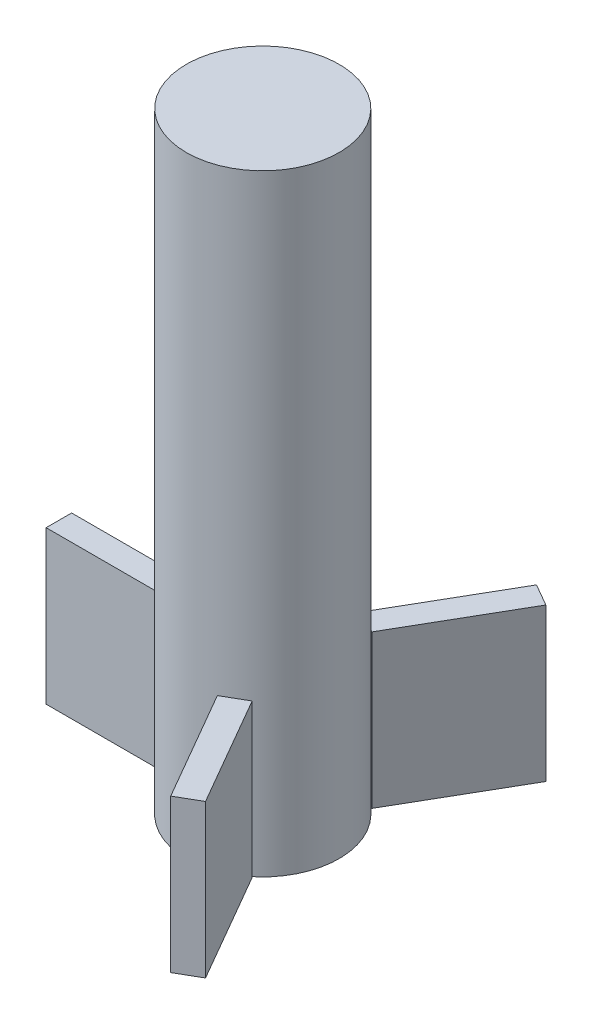
from build123d import *

# Parameters (mm, degrees)
CROQUIS3_R              = 15
SALIENTE_EXTRUIR1_DEPTH = 120
SALIENTE_EXTRUIR2_DEPTH = 30
CROQUIS3_4_W            = 25
CROQUIS3_4_H            = 5
SALIENTE_EXTRUIR3_DEPTH = 30
SALIENTE_EXTRUIR4_DEPTH = 30


with BuildPart() as part:
    # Croquis3 → Saliente-Extruir1 (new body)
    with BuildSketch(Plane(origin=(0, 0, 0), x_dir=(1, 0, 0), z_dir=(0, 1, 0))):
        Circle(CROQUIS3_R)
    extrude(amount=SALIENTE_EXTRUIR1_DEPTH)


with BuildPart() as body_2:
    # Croquis3<3> → Saliente-Extruir2 (new body)
    with BuildSketch(Plane(origin=(0, 0, 0), x_dir=(1, 0, 0), z_dir=(0, 1, 0))):
        Polygon((5.334936491, -14.240381057), (17.834936491, -35.891016151), (22.165063509, -33.391016151), (9.665063509, -11.740381057), align=None)
    extrude(amount=SALIENTE_EXTRUIR2_DEPTH)


with BuildPart() as body_3:
    # Croquis3<4> → Saliente-Extruir3 (new body)
    with BuildSketch(Plane(origin=(0, 0, 0), x_dir=(1, 0, 0), z_dir=(0, 1, 0))):
        with Locations((-27.5, 0)):
            Rectangle(CROQUIS3_4_W, CROQUIS3_4_H)
    extrude(amount=SALIENTE_EXTRUIR3_DEPTH)


with BuildPart() as body_4:
    # Croquis3<5> → Saliente-Extruir4 (new body)
    with BuildSketch(Plane(origin=(0, 0, 0), x_dir=(1, 0, 0), z_dir=(0, 1, 0))):
        Polygon((9.665063509, 11.740381057), (22.165063509, 33.391016151), (17.834936491, 35.891016151), (5.334936491, 14.240381057), align=None)
    extrude(amount=SALIENTE_EXTRUIR4_DEPTH)


solid = Compound([part.part, body_2.part, body_3.part, body_4.part])
